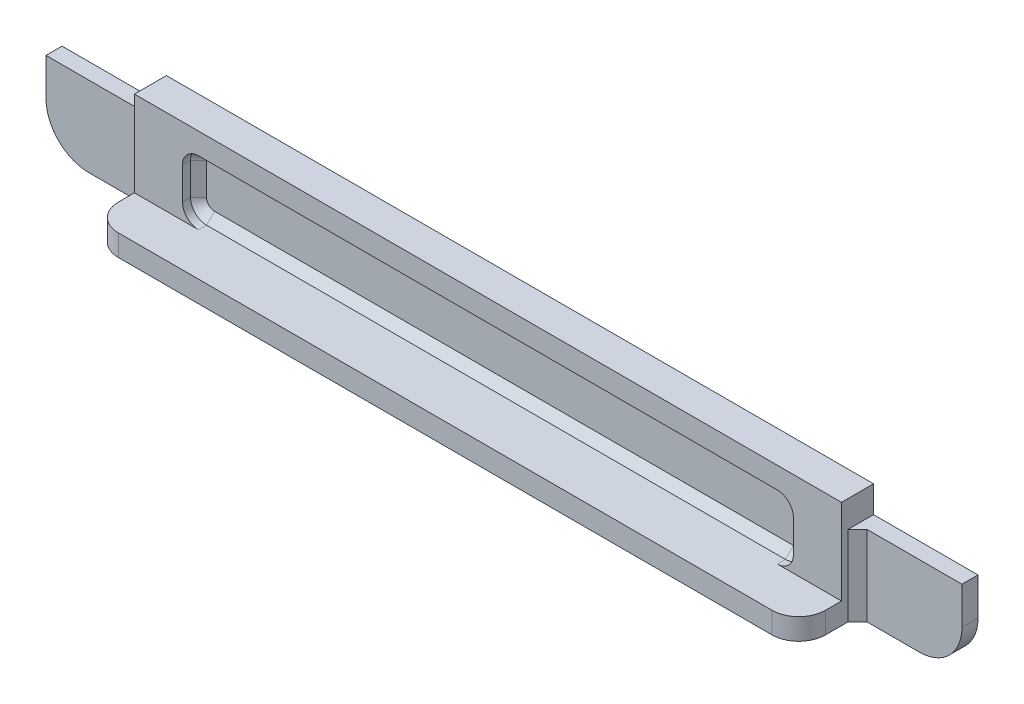
from build123d import *

# Parameters (mm, degrees)
SKETCH1_W           = 171.45
SKETCH1_H           = 20
BOSS_EXTRUDE1_DEPTH = 6
SKETCH2_W           = 19.55
SKETCH2_H           = 15
CUT_EXTRUDE1_DEPTH  = 3
SKETCH3_W           = 19.55
SKETCH3_H           = 5
CUT_EXTRUDE2_DEPTH  = 13
CHAMFER1_SIZE       = 1.8
SKETCH4_W           = 132.35
SKETCH4_H           = 4
BOSS_EXTRUDE2_DEPTH = 8
CUT_EXTRUDE3_DEPTH  = 3
CHAMFER2_SIZE       = 1.5
FILLET1_R           = 8
FILLET2_R           = 5


with BuildPart() as part:
    # Sketch1 → Boss-Extrude1 (new body)
    with BuildSketch(Plane.XY):
        Rectangle(SKETCH1_W, SKETCH1_H)
    extrude(amount=BOSS_EXTRUDE1_DEPTH)

    # Sketch2 → Cut-Extrude1 (cut)
    with BuildSketch(Plane.XY.offset(6)):
        with Locations((-75.95, -2.5)):
            Rectangle(SKETCH2_W, SKETCH2_H)
        with Locations((75.95, -2.5)):
            Rectangle(SKETCH2_W, SKETCH2_H)
    extrude(amount=-CUT_EXTRUDE1_DEPTH, mode=Mode.SUBTRACT)

    # Sketch3 → Cut-Extrude2 (cut)
    with BuildSketch(Plane.XY.offset(6)):
        with Locations((-75.95, 7.5)):
            Rectangle(SKETCH3_W, SKETCH3_H)
        with Locations((75.95, 7.5)):
            Rectangle(SKETCH3_W, SKETCH3_H)
    extrude(amount=-CUT_EXTRUDE2_DEPTH, mode=Mode.SUBTRACT)

    # Chamfer1
    chamfer1_edges = [part.edges().sort_by_distance(p)[0] for p in [
        (-66.175, -2.5, 3),
        (66.175, -2.5, 3),
    ]]
    chamfer(chamfer1_edges, length=CHAMFER1_SIZE)

    # Sketch4 → Boss-Extrude2 (add)
    with BuildSketch(Plane.XY.offset(6)):
        with Locations((0, -8)):
            Rectangle(SKETCH4_W, SKETCH4_H)
    extrude(amount=BOSS_EXTRUDE2_DEPTH)

    # Sketch5 → Cut-Extrude3 (cut)
    with BuildSketch(Plane.XY.offset(6)):
        with BuildLine():
            Line((-54.175, -6), (54.175, -6))
            ThreePointArc((54.175, -6), (56.296320344, -5.121320344), (57.175, -3))
            Line((57.175, -3), (57.175, 3))
            ThreePointArc((57.175, 3), (56.296320344, 5.121320344), (54.175, 6))
            Line((54.175, 6), (-54.175, 6))
            ThreePointArc((-54.175, 6), (-56.296320344, 5.121320344), (-57.175, 3))
            Line((-57.175, 3), (-57.175, -3))
            ThreePointArc((-57.175, -3), (-56.296320344, -5.121320344), (-54.175, -6))
        make_face()
    extrude(amount=-CUT_EXTRUDE3_DEPTH, mode=Mode.SUBTRACT)

    # Chamfer2
    chamfer2_edges = [part.edges().sort_by_distance(p)[0] for p in [
        (56.296320344, -5.121320344, 3),
        (0, -6, 3),
        (-56.296320344, -5.121320344, 3),
        (-57.175, 0, 3),
        (-56.296320344, 5.121320344, 3),
        (0, 6, 3),
        (56.296320344, 5.121320344, 3),
        (57.175, 0, 3),
    ]]
    chamfer(chamfer2_edges, length=CHAMFER2_SIZE)

    # Fillet1
    fillet1_edges = [part.edges().sort_by_distance(p)[0] for p in [
        (-85.725, -10, 1.5),
        (85.725, -10, 1.5),
    ]]
    fillet(fillet1_edges, radius=FILLET1_R)

    # Fillet2
    fillet2_edges = [part.edges().sort_by_distance(p)[0] for p in [
        (-66.175, -8, 14),
        (66.175, -8, 14),
    ]]
    fillet(fillet2_edges, radius=FILLET2_R)


solid = part.part
